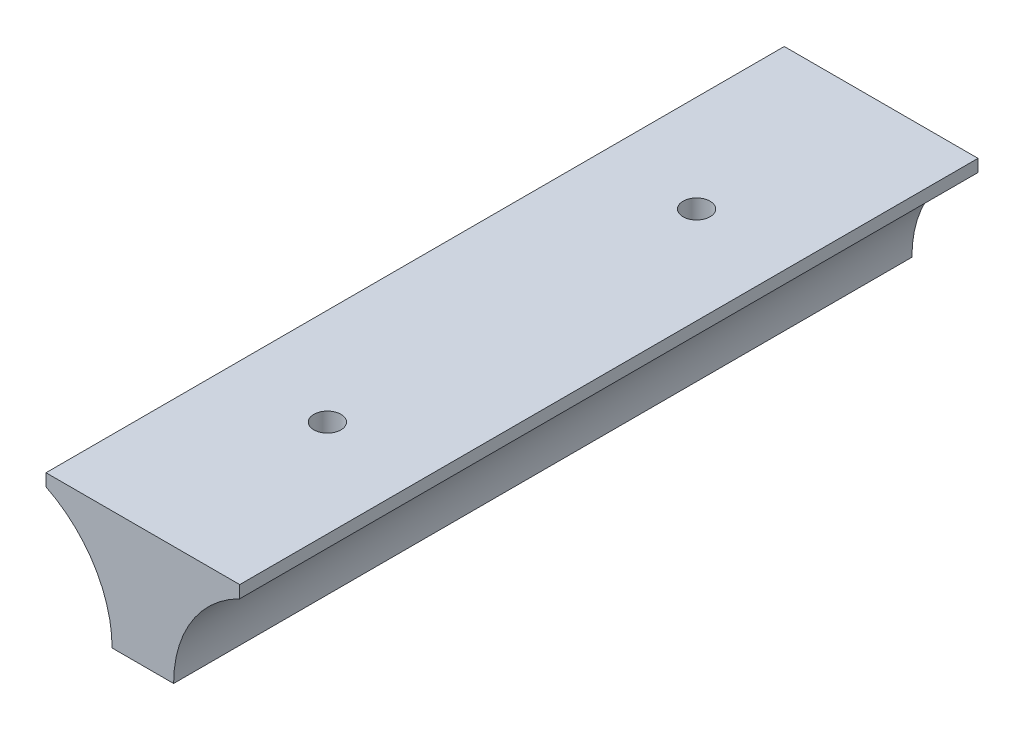
from build123d import *

# Parameters (mm, degrees)
BOSS_EXTRUDE1_DEPTH        = 60
F_2_2_2_2_DIAMETER_HOLE1_D = 2.2


with BuildPart() as part:
    # Sketch1 → Boss-Extrude1 (new body)
    with BuildSketch(Plane.XY):
        with BuildLine():
            Line((-2.5, 0), (2.5, 0))
            ThreePointArc((2.5, 0), (3.95232497, 5.091230117), (7.872150073, 8.65))
            Line((7.872150073, 8.65), (7.872150073, 9.65))
            Line((7.872150073, 9.65), (-7.872150073, 9.65))
            Line((-7.872150073, 9.65), (-7.872150073, 8.65))
            ThreePointArc((-7.872150073, 8.65), (-3.95232497, 5.091230117), (-2.5, 0))
        make_face()
    extrude(amount=BOSS_EXTRUDE1_DEPTH)

    # Ø2.2 (2.2) Diameter Hole1 (through all)
    with Locations(Plane(origin=(0, 9.65, 45), x_dir=(0, 0, 1), z_dir=(0, 1, 0))):
        with Locations((0, 0), (-30, 0)):
            Hole(F_2_2_2_2_DIAMETER_HOLE1_D / 2)


solid = part.part
